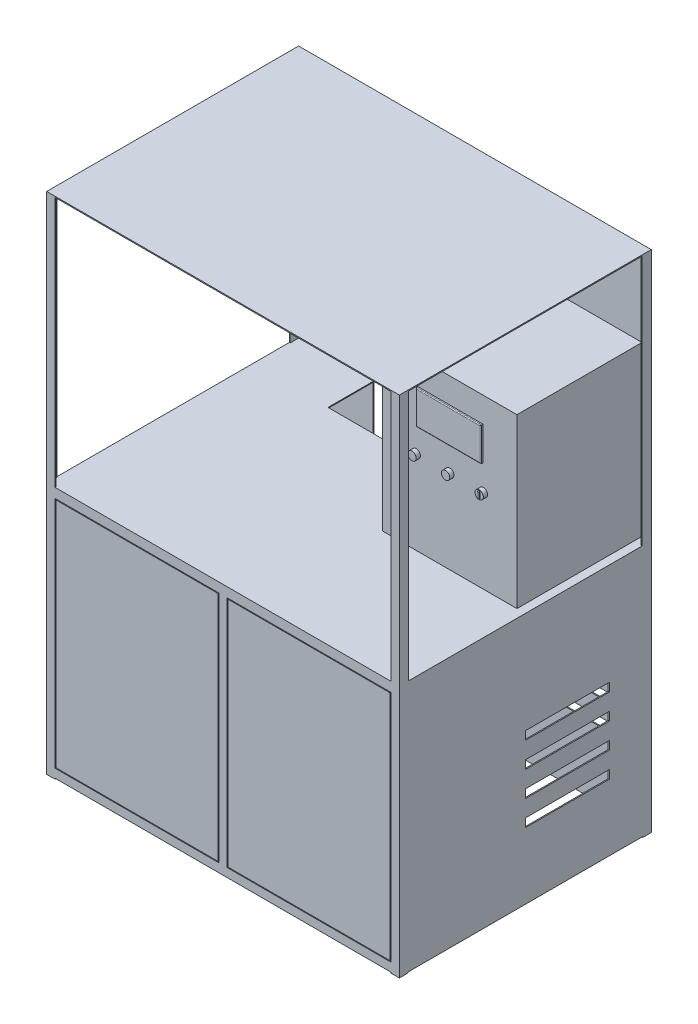
from build123d import *

# Parameters (mm, degrees)
SKETCH1_W            = 1066.8
SKETCH1_H            = 762
BOSS_EXTRUDE1_DEPTH  = 2.54
SKETCH2_W            = 203.2
SKETCH2_H            = 139.7
CUT_EXTRUDE1_DEPTH   = 656.50210648
SKETCH3_W            = 25.4
SKETCH3_H            = 25.4
BOSS_EXTRUDE2_DEPTH  = 762
SKETCH4_W            = 406.4
SKETCH4_H            = 381
BOSS_EXTRUDE3_DEPTH  = 508
SKETCH5_R            = 12.7
BOSS_EXTRUDE4_DEPTH  = 12.7
SKETCH6_W            = 3.94766101
SKETCH6_H            = 20.265990969
BOSS_EXTRUDE5_DEPTH  = 3.175
FILLET1_R            = 2.54
SKETCH7_W            = 196.85
SKETCH7_H            = 101.6
BOSS_EXTRUDE6_DEPTH  = 6.35
FILLET2_R            = 2.54
SKETCH8_W            = 2.54
SKETCH8_H            = 25.4
SKETCH8_W_2          = 203.2
SKETCH8_H_2          = 2.54
SKETCH8_W_3          = 406.4
BOSS_EXTRUDE7_DEPTH  = 759.46
SKETCH9_W            = 1066.8
SKETCH9_H            = 762
BOSS_EXTRUDE8_DEPTH  = 3.175
SKETCH11_W           = 1016
SKETCH11_H           = 3.175
SKETCH11_W_2         = 3.175
SKETCH11_H_2         = 711.2
SKETCH11_W_3         = 203.2
SKETCH11_W_4         = 609.6
BOSS_EXTRUDE10_DEPTH = 759.46
CUT_EXTRUDE3_REACH   = 1366.534
SKETCH12_W           = 254
SKETCH12_H           = 25.4
CUT_EXTRUDE4_REACH   = 1206.43
SKETCH13_W           = 254
SKETCH13_H           = 25.4
SKETCH14_W           = 495.3
SKETCH14_H           = 706.721299259
SKETCH14_W_2         = 490.22
SKETCH14_H_2         = 701.641299259
CUT_EXTRUDE5_DEPTH   = 2.54


with BuildPart() as part:
    # Sketch1 → Boss-Extrude1 (new body)
    with BuildSketch(Plane(origin=(0, 0, 0), x_dir=(1, 0, 0), z_dir=(0, 1, 0))):
        Rectangle(SKETCH1_W, SKETCH1_H)
    extrude(amount=BOSS_EXTRUDE1_DEPTH)

    # Sketch2 → Cut-Extrude1 (cut, through all)
    with BuildSketch(Plane(origin=(0, 2.54, 0), x_dir=(1, 0, 0), z_dir=(0, 1, 0))):
        with Locations((-203.2, 311.15)):
            Rectangle(SKETCH2_W, SKETCH2_H)
    extrude(amount=-CUT_EXTRUDE1_DEPTH, mode=Mode.SUBTRACT)

    # Sketch3 → Boss-Extrude2 (add)
    with BuildSketch(Plane.XZ):
        with Locations((-520.7, 368.3)):
            Rectangle(SKETCH3_W, SKETCH3_H)
        with Locations((520.7, 368.3)):
            Rectangle(SKETCH3_W, SKETCH3_H)
        with Locations((520.7, -368.3)):
            Rectangle(SKETCH3_W, SKETCH3_H)
        with Locations((-520.7, -368.3)):
            Rectangle(SKETCH3_W, SKETCH3_H)
    extrude(amount=BOSS_EXTRUDE2_DEPTH)

    # Sketch4 → Boss-Extrude3 (add)
    with BuildSketch(Plane(origin=(0, 2.54, 0), x_dir=(1, 0, 0), z_dir=(0, 1, 0))):
        with Locations((304.8, 190.5)):
            Rectangle(SKETCH4_W, SKETCH4_H)
    extrude(amount=BOSS_EXTRUDE3_DEPTH)

    # Sketch5 → Boss-Extrude4 (add)
    with BuildSketch(Plane.XY):
        with Locations(Location((203.2, 256.54, 0), (0, 0, 180))):
            Circle(SKETCH5_R)
        with Locations(Location((304.8, 256.54, 0), (0, 0, 180))):
            Circle(SKETCH5_R)
        with Locations(Location((406.4, 256.54, 0), (0, 0, 180))):
            Circle(SKETCH5_R)
    extrude(amount=BOSS_EXTRUDE4_DEPTH)

    # Sketch6 → Boss-Extrude5 (add)
    with BuildSketch(Plane.XY.offset(12.7)):
        with Locations((406.4, 256.600571442)):
            Rectangle(SKETCH6_W, SKETCH6_H)
    extrude(amount=BOSS_EXTRUDE5_DEPTH)

    # Fillet1
    fillet1_edges = [part.edges().sort_by_distance(p)[0] for p in [
        (406.4, 266.733566926, 15.875),
    ]]
    fillet(fillet1_edges, radius=FILLET1_R)

    # Sketch7 → Boss-Extrude6 (add)
    with BuildSketch(Plane.XY):
        with Locations((306.763896215, 383.54)):
            Rectangle(SKETCH7_W, SKETCH7_H)
    extrude(amount=BOSS_EXTRUDE6_DEPTH)

    # Fillet2
    fillet2_edges = [part.edges().sort_by_distance(p)[0] for p in [
        (208.338896215, 383.54, 6.35),
        (306.763896215, 332.74, 6.35),
        (405.188896215, 383.54, 6.35),
        (306.763896215, 434.34, 6.35),
    ]]
    fillet(fillet2_edges, radius=FILLET2_R)

    # Sketch8 → Boss-Extrude7 (add)
    with BuildSketch(Plane(origin=(0, 2.54, 0), x_dir=(1, 0, 0), z_dir=(0, 1, 0))):
        Polygon((-304.8, 381), (-533.4, 381), (-533.4, 378.46), (-530.86, 378.46), (-304.8, 378.46), align=None)
        with Locations((-532.13, 365.76)):
            Rectangle(SKETCH8_W, SKETCH8_H)
        Polygon((530.86, 378.46), (533.4, 378.46), (533.4, 381), (508, 381), (508, 378.46), align=None)
        with Locations((532.13, 365.76)):
            Rectangle(SKETCH8_W, SKETCH8_H)
        with Locations((0, 379.73)):
            Rectangle(SKETCH8_W_2, SKETCH8_H_2)
        Polygon((508, -378.46), (508, -381), (533.4, -381), (533.4, -378.46), (530.86, -378.46), align=None)
        with Locations((532.13, -365.76)):
            Rectangle(SKETCH8_W, SKETCH8_H)
        with Locations((-532.13, -365.76)):
            Rectangle(SKETCH8_W, SKETCH8_H)
        Polygon((-530.86, -378.46), (-533.4, -378.46), (-533.4, -381), (-508, -381), (-508, -378.46), align=None)
        with Locations((304.8, 379.73)):
            Rectangle(SKETCH8_W_3, SKETCH8_H_2)
    extrude(amount=BOSS_EXTRUDE7_DEPTH)

    # Sketch9 → Boss-Extrude8 (add)
    with BuildSketch(Plane(origin=(0, 762, 0), x_dir=(1, 0, 0), z_dir=(0, 1, 0))):
        Rectangle(SKETCH9_W, SKETCH9_H)
    extrude(amount=BOSS_EXTRUDE8_DEPTH)

    # Sketch11 → Boss-Extrude10 (add)
    with BuildSketch(Plane.XZ):
        with Locations((0, 379.4125)):
            Rectangle(SKETCH11_W, SKETCH11_H)
        with Locations((531.8125, 0)):
            Rectangle(SKETCH11_W_2, SKETCH11_H_2)
        with Locations((-531.8125, 0)):
            Rectangle(SKETCH11_W_2, SKETCH11_H_2)
        with Locations((-406.4, -379.4125)):
            Rectangle(SKETCH11_W_3, SKETCH11_H)
        with Locations((203.2, -379.4125)):
            Rectangle(SKETCH11_W_4, SKETCH11_H)
    extrude(amount=BOSS_EXTRUDE10_DEPTH)

    # Sketch12 → Cut-Extrude3 (cut, up to next)
    with BuildSketch(Plane.ZY.offset(-530.225), mode=Mode.PRIVATE) as cut_extrude3_sk1:
        with Locations((-127, -317.5)):
            Rectangle(SKETCH12_W, SKETCH12_H)
    cut_extrude3_tool1 = extrude(cut_extrude3_sk1.sketch, amount=-CUT_EXTRUDE3_REACH, mode=Mode.PRIVATE) & part.part
    # Sketch12 → Cut-Extrude3 (cut, up to next)
    with BuildSketch(Plane.ZY.offset(-530.225), mode=Mode.PRIVATE) as cut_extrude3_sk2:
        with Locations((-127, -393.7)):
            Rectangle(SKETCH12_W, SKETCH12_H)
    cut_extrude3_tool2 = extrude(cut_extrude3_sk2.sketch, amount=-CUT_EXTRUDE3_REACH, mode=Mode.PRIVATE) & part.part
    # Sketch12 → Cut-Extrude3 (cut, up to next)
    with BuildSketch(Plane.ZY.offset(-530.225), mode=Mode.PRIVATE) as cut_extrude3_sk3:
        with Locations((-127, -469.9)):
            Rectangle(SKETCH12_W, SKETCH12_H)
    cut_extrude3_tool3 = extrude(cut_extrude3_sk3.sketch, amount=-CUT_EXTRUDE3_REACH, mode=Mode.PRIVATE) & part.part
    # Sketch12 → Cut-Extrude3 (cut, up to next)
    with BuildSketch(Plane.ZY.offset(-530.225), mode=Mode.PRIVATE) as cut_extrude3_sk4:
        with Locations((-127, -546.1)):
            Rectangle(SKETCH12_W, SKETCH12_H)
    cut_extrude3_tool4 = extrude(cut_extrude3_sk4.sketch, amount=-CUT_EXTRUDE3_REACH, mode=Mode.PRIVATE) & part.part
    add(cut_extrude3_tool1.solids().sort_by_distance((530.225, -317.5, -127))[0], mode=Mode.SUBTRACT)
    add(cut_extrude3_tool2.solids().sort_by_distance((530.225, -393.7, -127))[0], mode=Mode.SUBTRACT)
    add(cut_extrude3_tool3.solids().sort_by_distance((530.225, -469.9, -127))[0], mode=Mode.SUBTRACT)
    add(cut_extrude3_tool4.solids().sort_by_distance((530.225, -546.1, -127))[0], mode=Mode.SUBTRACT)

    # Sketch13 → Cut-Extrude4 (cut, up to next)
    with BuildSketch(Plane(origin=(0, 0, -381), x_dir=(-1, 0, 0), z_dir=(0, 0, -1)), mode=Mode.PRIVATE) as cut_extrude4_sk1:
        with Locations((-279.4, -317.5)):
            Rectangle(SKETCH13_W, SKETCH13_H)
    cut_extrude4_tool1 = extrude(cut_extrude4_sk1.sketch, amount=-CUT_EXTRUDE4_REACH, mode=Mode.PRIVATE) & part.part
    # Sketch13 → Cut-Extrude4 (cut, up to next)
    with BuildSketch(Plane(origin=(0, 0, -381), x_dir=(-1, 0, 0), z_dir=(0, 0, -1)), mode=Mode.PRIVATE) as cut_extrude4_sk2:
        with Locations((-279.4, -393.7)):
            Rectangle(SKETCH13_W, SKETCH13_H)
    cut_extrude4_tool2 = extrude(cut_extrude4_sk2.sketch, amount=-CUT_EXTRUDE4_REACH, mode=Mode.PRIVATE) & part.part
    # Sketch13 → Cut-Extrude4 (cut, up to next)
    with BuildSketch(Plane(origin=(0, 0, -381), x_dir=(-1, 0, 0), z_dir=(0, 0, -1)), mode=Mode.PRIVATE) as cut_extrude4_sk3:
        with Locations((-279.4, -469.9)):
            Rectangle(SKETCH13_W, SKETCH13_H)
    cut_extrude4_tool3 = extrude(cut_extrude4_sk3.sketch, amount=-CUT_EXTRUDE4_REACH, mode=Mode.PRIVATE) & part.part
    # Sketch13 → Cut-Extrude4 (cut, up to next)
    with BuildSketch(Plane(origin=(0, 0, -381), x_dir=(-1, 0, 0), z_dir=(0, 0, -1)), mode=Mode.PRIVATE) as cut_extrude4_sk4:
        with Locations((-279.4, -546.1)):
            Rectangle(SKETCH13_W, SKETCH13_H)
    cut_extrude4_tool4 = extrude(cut_extrude4_sk4.sketch, amount=-CUT_EXTRUDE4_REACH, mode=Mode.PRIVATE) & part.part
    add(cut_extrude4_tool1.solids().sort_by_distance((279.4, -317.5, -381))[0], mode=Mode.SUBTRACT)
    add(cut_extrude4_tool2.solids().sort_by_distance((279.4, -393.7, -381))[0], mode=Mode.SUBTRACT)
    add(cut_extrude4_tool3.solids().sort_by_distance((279.4, -469.9, -381))[0], mode=Mode.SUBTRACT)
    add(cut_extrude4_tool4.solids().sort_by_distance((279.4, -546.1, -381))[0], mode=Mode.SUBTRACT)

    # Sketch14 → Cut-Extrude5 (cut)
    # profile 1 of 2: a face of its own
    with BuildSketch(Plane.XY.offset(381)):
        with Locations((-260.35, -379.817122747)):
            Rectangle(SKETCH14_W, SKETCH14_H)
        with Locations((-260.35, -379.817122748)):
            Rectangle(SKETCH14_W_2, SKETCH14_H_2, mode=Mode.SUBTRACT)
    # profile 2 of 2: a face of its own
    with BuildSketch(Plane.XY.offset(381)):
        with Locations((260.35, -379.817122747)):
            Rectangle(SKETCH14_W, SKETCH14_H)
        with Locations((260.35, -379.817122748)):
            Rectangle(SKETCH14_W_2, SKETCH14_H_2, mode=Mode.SUBTRACT)
    extrude(amount=-CUT_EXTRUDE5_DEPTH, mode=Mode.SUBTRACT)


solid = part.part
